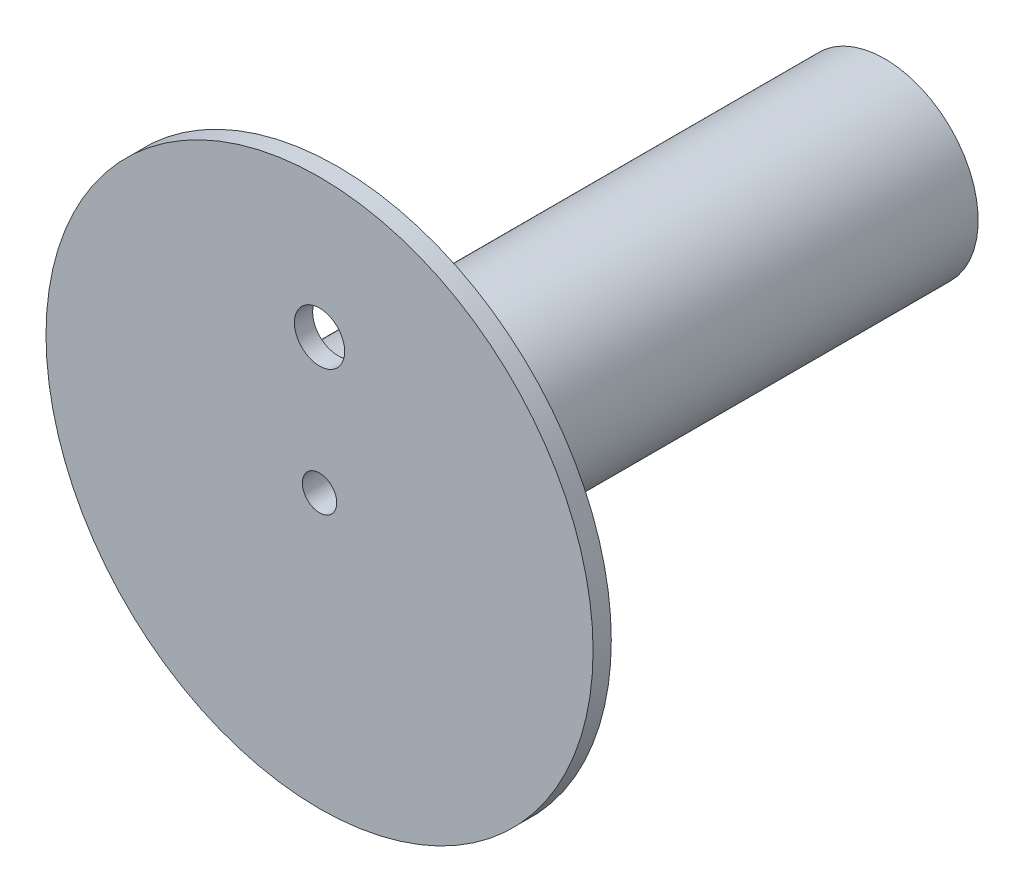
from build123d import *

# Parameters (mm, degrees)
SKETCH1_R           = 6.5
BOSS_EXTRUDE1_DEPTH = 38.1
SKETCH2_R           = 19.05
BOSS_EXTRUDE2_DEPTH = 1.27
SKETCH3_R           = 1.2
CUT_EXTRUDE1_DEPTH  = 48.705365526
SKETCH4_R           = 1.75
CUT_EXTRUDE2_DEPTH  = 7.62


with BuildPart() as part:
    # Sketch1 → Boss-Extrude1 (new body)
    with BuildSketch(Plane.XY):
        with Locations(Location((0, 0, 0), (0, 0, 180))):
            Circle(SKETCH1_R)
    extrude(amount=BOSS_EXTRUDE1_DEPTH)

    # Sketch2 → Boss-Extrude2 (add)
    with BuildSketch(Plane.XY.offset(38.1)):
        Circle(SKETCH2_R)
    extrude(amount=BOSS_EXTRUDE2_DEPTH)

    # Sketch3 → Cut-Extrude1 (cut, through all)
    with BuildSketch(Plane(origin=(0, 0, 0), x_dir=(-1, 0, 0), z_dir=(0, 0, -1))):
        Circle(SKETCH3_R)
    extrude(amount=-CUT_EXTRUDE1_DEPTH, mode=Mode.SUBTRACT)

    # Sketch4 → Cut-Extrude2 (cut)
    with BuildSketch(Plane(origin=(0, 0, 38.1), x_dir=(-1, 0, 0), z_dir=(0, 0, -1))):
        with Locations((0, 9.398)):
            Circle(SKETCH4_R)
    extrude(amount=-CUT_EXTRUDE2_DEPTH, mode=Mode.SUBTRACT)


solid = part.part
